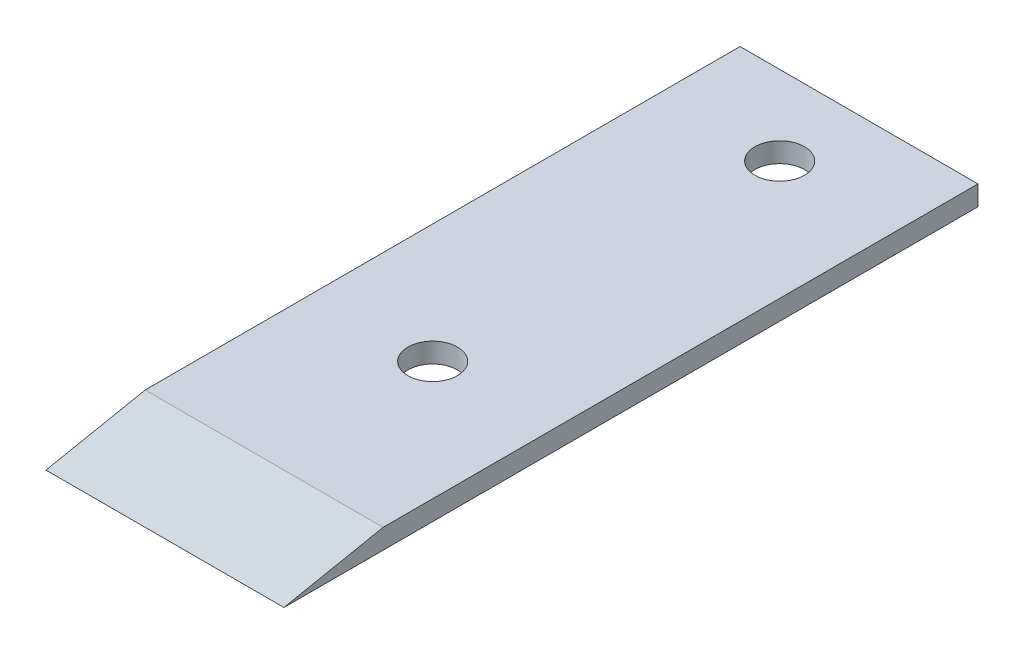
from build123d import *

# Parameters (mm, degrees)
SKETCH_1_W               = 24
SKETCH_1_H               = 70
EXTRUDE_1_DEPTH          = 2
SKETCH_2_R               = 2.5
CUT_EXTRUDE_1_DEPTH      = 38.054014627
CUT_EXTRUDE_2_DEPTH      = 43.485291572
CUT_EXTRUDE_2_DEPTH_BACK = 43.485291572


with BuildPart() as part:
    # 草图1 → 凸台-拉伸1 (new body)
    with BuildSketch(Plane(origin=(0, 0, 0), x_dir=(1, 0, 0), z_dir=(0, 1, 0))):
        Rectangle(SKETCH_1_W, SKETCH_1_H)
    extrude(amount=EXTRUDE_1_DEPTH)

    # 草图2 → 切除-拉伸1 (cut, through all)
    with BuildSketch(Plane(origin=(0, 2, 0), x_dir=(1, 0, 0), z_dir=(0, 1, 0))):
        with Locations(Location((0, -8, 0), (0, 0, 270))):
            Circle(SKETCH_2_R)
        with Locations(Location((0, 27, 0), (0, 0, 270))):
            Circle(SKETCH_2_R)
    extrude(amount=-CUT_EXTRUDE_1_DEPTH, mode=Mode.SUBTRACT)

    # 草图3 → 切除-拉伸2 (cut, two sides: drawn at the far end of the back side and taken through both)
    with BuildSketch(Plane(origin=(12, 0, 0), x_dir=(0, 0, -1), z_dir=(1, 0, 0)).offset(-CUT_EXTRUDE_2_DEPTH_BACK)):
        Polygon((-182.143123104, -29.428624621), (-35, 0), (-25, 2), (122.143123104, 31.428624621), (63.285873863, 325.71487083), (-241.000372346, 264.857621588), align=None)
    extrude(amount=CUT_EXTRUDE_2_DEPTH + CUT_EXTRUDE_2_DEPTH_BACK, mode=Mode.SUBTRACT)


solid = part.part
